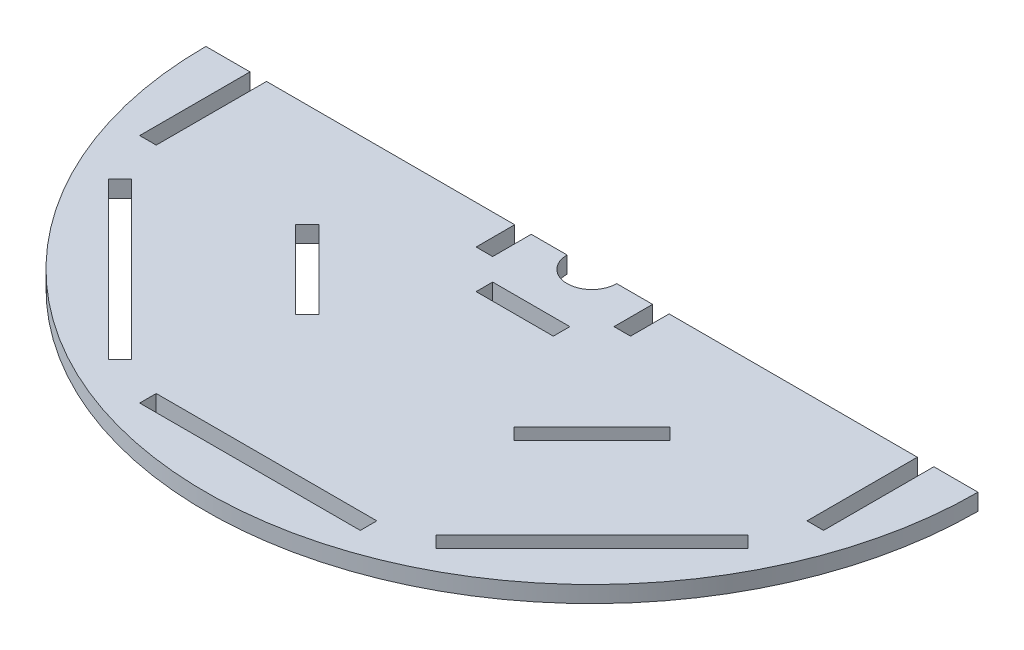
from build123d import *

# Parameters (mm, degrees)
SALIENTE_EXTRUIR1_DEPTH = 3


with BuildPart() as part:
    # Croquis1 → Saliente-Extruir1 (new body)
    with BuildSketch(Plane(origin=(0, 0, 0), x_dir=(1, 0, 0), z_dir=(0, 1, 0))):
        with BuildLine():
            Line((-59, 0), (-17, 0))
            Line((-17, 0), (-14, 0))
            Line((-14, 0), (-14, -7))
            Line((-14, -7), (-11, -7))
            Line((-11, -7), (-11, 0))
            Line((-11, 0), (-4.5, 0))
            ThreePointArc((-4.5, 0), (0, -4.5), (4.5, 0))
            Line((4.5, 0), (11, 0))
            Line((11, 0), (11, -7))
            Line((11, -7), (14, -7))
            Line((14, -7), (14, 0))
            Line((14, 0), (17, 0))
            Line((17, 0), (59, 0))
            Line((59, 0), (59, -20))
            Line((59, -20), (62, -20))
            Line((62, -20), (62, 0))
            Line((62, 0), (70, 0))
            ThreePointArc((70, 0), (0, -70), (-70, 0))
            Line((-70, 0), (-62, 0))
            Line((-62, 0), (-62, -20))
            Line((-62, -20), (-59, -20))
            Line((-59, -20), (-59, 0))
        make_face()
        Polygon((-7, -14), (7, -14), (7, -11), (0, -11), (-7, -11), align=None, mode=Mode.SUBTRACT)
        Polygon((24.748737342, -24.748737342), (17.67766953, -31.819805153), (19.798989873, -33.941125497), (33.941125497, -19.798989873), (31.819805153, -17.67766953), align=None, mode=Mode.SUBTRACT)
        Polygon((-24.748737342, -24.748737342), (-31.819805153, -17.67766953), (-33.941125497, -19.798989873), (-19.798989873, -33.941125497), (-17.67766953, -31.819805153), align=None, mode=Mode.SUBTRACT)
        Polygon((27.577164466, -55.861435714), (55.861435714, -27.577164466), (57.982756057, -29.69848481), (43.840620434, -43.840620434), (29.69848481, -57.982756057), align=None, mode=Mode.SUBTRACT)
        Polygon((-20, -59), (20, -59), (20, -62), (0, -62), (-20, -62), align=None, mode=Mode.SUBTRACT)
        Polygon((-55.861435714, -27.577164466), (-27.577164466, -55.861435714), (-29.69848481, -57.982756057), (-43.840620434, -43.840620434), (-57.982756057, -29.69848481), align=None, mode=Mode.SUBTRACT)
    extrude(amount=SALIENTE_EXTRUIR1_DEPTH)


solid = part.part
